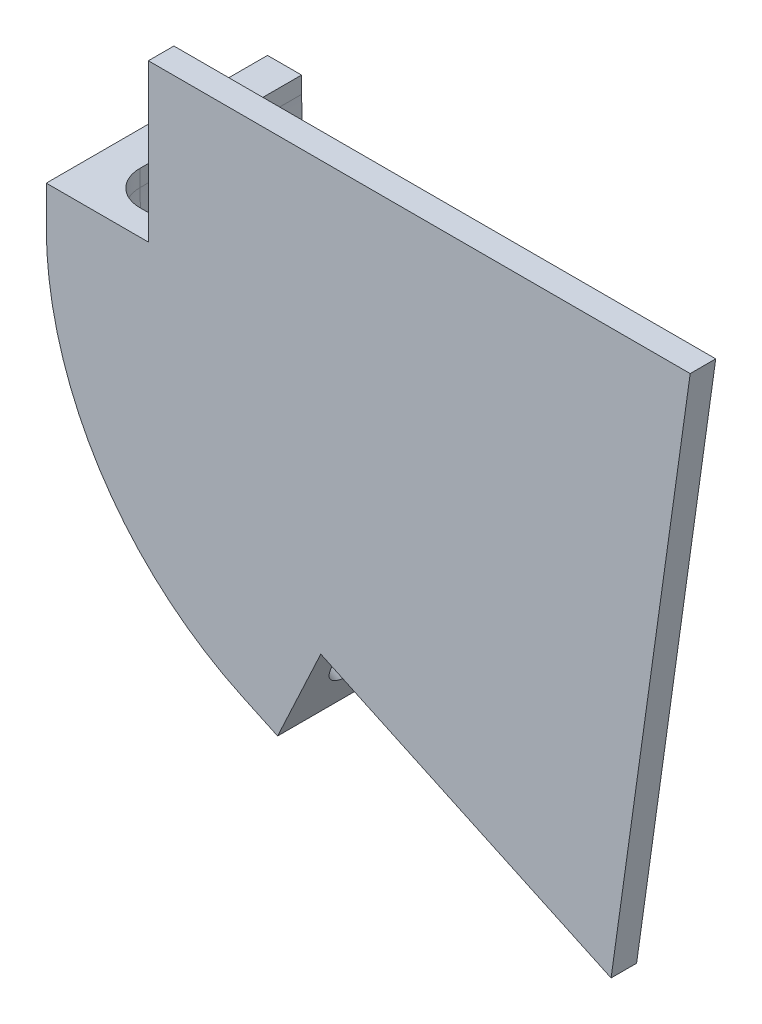
from build123d import *

# Parameters (mm, degrees)
BOSS_EXTRUDE1_DEPTH = 1.5
BOSS_EXTRUDE2_DEPTH = 13
CUT_EXTRUDE3_DEPTH  = 11.5
FILLET7_R           = 20
FILLET8_R           = 2
SKETCH5_R           = 1.6
CUT_EXTRUDE4_DEPTH  = 5.75


with BuildPart() as part:
    # Sketch1 → Boss-Extrude1 (new body)
    with BuildSketch(Plane.XY):
        Polygon((-4.481783153, -31.006256204), (9.112833652, -37.34553013), (13.762412955, -4.262054337), (-18.076399959, -4.262054337), (-18.076399959, -9.666982278), (-18.076399959, -24.666982278), align=None)
    extrude(amount=BOSS_EXTRUDE1_DEPTH)

    # Sketch2 → Boss-Extrude2 (add)
    with BuildSketch(Plane(origin=(0, 0, 0), x_dir=(-1, 0, 0), z_dir=(0, 0, -1))):
        Polygon((24.076399959, -28.489403843), (24.076399959, -13.489403843), (17.076399959, -13.489403843), (17.076399959, -24.029912017), (7.523455321, -28.48452326), (10.481783153, -34.828677769), align=None)
    extrude(amount=-BOSS_EXTRUDE2_DEPTH)

    # Sketch4 → Cut-Extrude3 (cut)
    with BuildSketch(Plane.XY.offset(13)):
        Polygon((-17.076399959, -13.489403843), (-22.076399959, -13.489403843), (-22.076399959, -27.215263321), (-9.63654663, -33.016062195), (-7.523455321, -28.48452326), (-17.076399959, -24.029912017), align=None)
    extrude(amount=-CUT_EXTRUDE3_DEPTH, mode=Mode.SUBTRACT)

    # Fillet7
    fillet7_edges = [part.edges().sort_by_distance(p)[0] for p in [
        (-24.076399959, -28.489403843, 6.5),
        (-22.076399959, -27.215263321, 7.25),
    ]]
    fillet(fillet7_edges, radius=FILLET7_R)

    # Fillet8
    fillet8_edges = [part.edges().sort_by_distance(p)[0] for p in [
        (-22.076399959, -13.981630974, 1.5),
        (-10.082655912, -32.808038021, 1.5),
        (-18.944228875, -25.219850272, 1.5),
    ]]
    fillet(fillet8_edges, radius=FILLET8_R)

    # Sketch5 → Cut-Extrude4 (cut, symmetric)
    with BuildSketch(Plane(origin=(-22.076399959, 0, 0), x_dir=(0, 0, -1), z_dir=(1, 0, 0))):
        with Locations(Location((-9, -23.189403843, 0), (0, 0, 90))):
            Circle(SKETCH5_R)
    extrude(amount=CUT_EXTRUDE4_DEPTH, both=True, mode=Mode.SUBTRACT)


with BuildPart() as body_2:
    # Mirror2: mirrored copy
    add(part.part.mirror(Plane.XY.offset(13)))


solid = body_2.part
